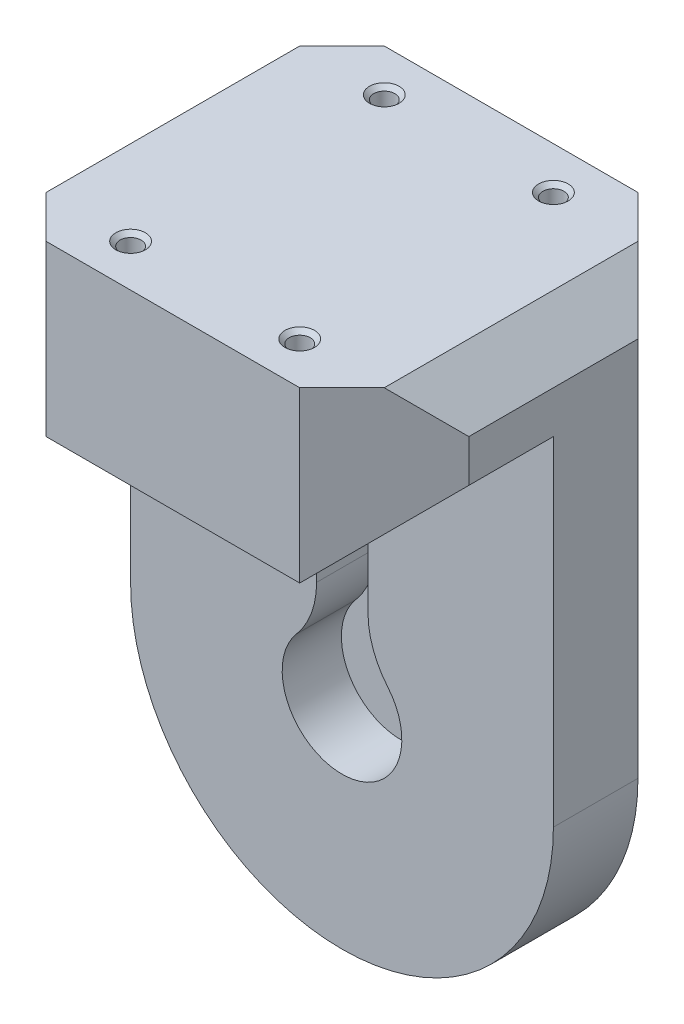
from build123d import *

# Parameters (mm, degrees)
BOSS_EXTRUDE1_DEPTH = 10
CHAMFER1_SIZE       = 10
CUT_EXTRUDE3_DEPTH  = 7
SKETCH7_R           = 4
CUT_EXTRUDE4_DEPTH  = 11
SKETCH8_R           = 1.5
CUT_EXTRUDE5_DEPTH  = 11
SKETCH9_W           = 50
SKETCH9_H           = 20
BOSS_EXTRUDE2_DEPTH = 20
CHAMFER2_SIZE       = 10
CHAMFER3_SIZE       = 5
SKETCH10_R          = 1.25
CUT_EXTRUDE6_DEPTH  = 10
CHAMFER4_SIZE       = 0.5


with BuildPart() as part:
    # Sketch1 → Boss-Extrude1 (new, symmetric)
    with BuildSketch(Plane.XY):
        with BuildLine():
            Line((25, 50), (25, 0))
            ThreePointArc((25, 0), (0, -25), (-25, 0))
            Line((-25, 0), (-25, 50))
            Line((-25, 50), (25, 50))
        make_face()
    extrude(amount=BOSS_EXTRUDE1_DEPTH, both=True)

    # Chamfer1
    chamfer1_edges = [part.edges().sort_by_distance(p)[0] for p in [
        (25, 25, -10),
        (0, -25, -10),
        (-25, 25, -10),
    ]]
    chamfer(chamfer1_edges, length=CHAMFER1_SIZE)

    # Sketch6 → Cut-Extrude3 (cut)
    with BuildSketch(Plane.XY.offset(10)):
        with BuildLine():
            Line((3.075, 10.981803131), (3.075, 24.5))
            ThreePointArc((3.075, 24.5), (-0.339576943, 27.556192484), (-3, 23.825))
            Line((-3, 23.825), (-3, 11.070484407))
            ThreePointArc((-3, 11.070484407), (-3.615579404, 7.616117595), (-5.386530015, 4.587038195))
            ThreePointArc((-5.386530015, 4.587038195), (-0.02406199, -7.074959083), (5.417606149, 4.550293244))
            ThreePointArc((5.417606149, 4.550293244), (3.678885417, 7.559372599), (3.075, 10.981803131))
        make_face()
    extrude(amount=-CUT_EXTRUDE3_DEPTH, mode=Mode.SUBTRACT)

    # Sketch7 → Cut-Extrude4 (cut)
    with BuildSketch(Plane(origin=(0, 0, -10), x_dir=(-1, 0, 0), z_dir=(0, 0, -1))):
        Circle(SKETCH7_R)
        with Locations((0, 24.5)):
            Circle(SKETCH7_R)
    extrude(amount=-CUT_EXTRUDE4_DEPTH, mode=Mode.SUBTRACT)

    # Sketch8 → Cut-Extrude5 (cut)
    with BuildSketch(Plane(origin=(0, 0, 1), x_dir=(-1, 0, 0), z_dir=(0, 0, -1))):
        with Locations((0, 24.5)):
            Circle(SKETCH8_R)
        Circle(SKETCH8_R)
    extrude(amount=-CUT_EXTRUDE5_DEPTH, mode=Mode.SUBTRACT)

    # Sketch9 → Boss-Extrude2 (add)
    with BuildSketch(Plane.XY.offset(10)):
        with Locations((0, 40)):
            Rectangle(SKETCH9_W, SKETCH9_H)
    extrude(amount=BOSS_EXTRUDE2_DEPTH)

    # Chamfer2
    chamfer2_edges = [part.edges().sort_by_distance(p)[0] for p in [
        (25, 30, 20),
        (-25, 30, 20),
        (25, 40, 30),
        (-25, 40, 30),
    ]]
    chamfer(chamfer2_edges, length=CHAMFER2_SIZE)

    # Chamfer3
    chamfer3_edges = [part.edges().sort_by_distance(p)[0] for p in [
        (-25, 50, 10),
        (25, 50, 10),
    ]]
    chamfer(chamfer3_edges, length=CHAMFER3_SIZE)

    # Sketch10 → Cut-Extrude6 (cut)
    with BuildSketch(Plane(origin=(0, 50, 0), x_dir=(1, 0, 0), z_dir=(0, 1, 0))):
        with Locations(Location((10, 5, 0), (0, 0, 270))):
            Circle(SKETCH10_R)
        with Locations(Location((10, -25, 0), (0, 0, 90))):
            Circle(SKETCH10_R)
        with Locations(Location((-10, -25, 0), (0, 0, 270))):
            Circle(SKETCH10_R)
        with Locations(Location((-10, 5, 0), (0, 0, 90))):
            Circle(SKETCH10_R)
    extrude(amount=-CUT_EXTRUDE6_DEPTH, mode=Mode.SUBTRACT)

    # Chamfer4
    chamfer4_edges = [part.edges().sort_by_distance(p)[0] for p in [
        (-10, 50, -3.75),
        (-10, 50, 23.75),
        (10, 50, 26.25),
        (10, 50, -6.25),
    ]]
    chamfer(chamfer4_edges, length=CHAMFER4_SIZE)


solid = part.part
